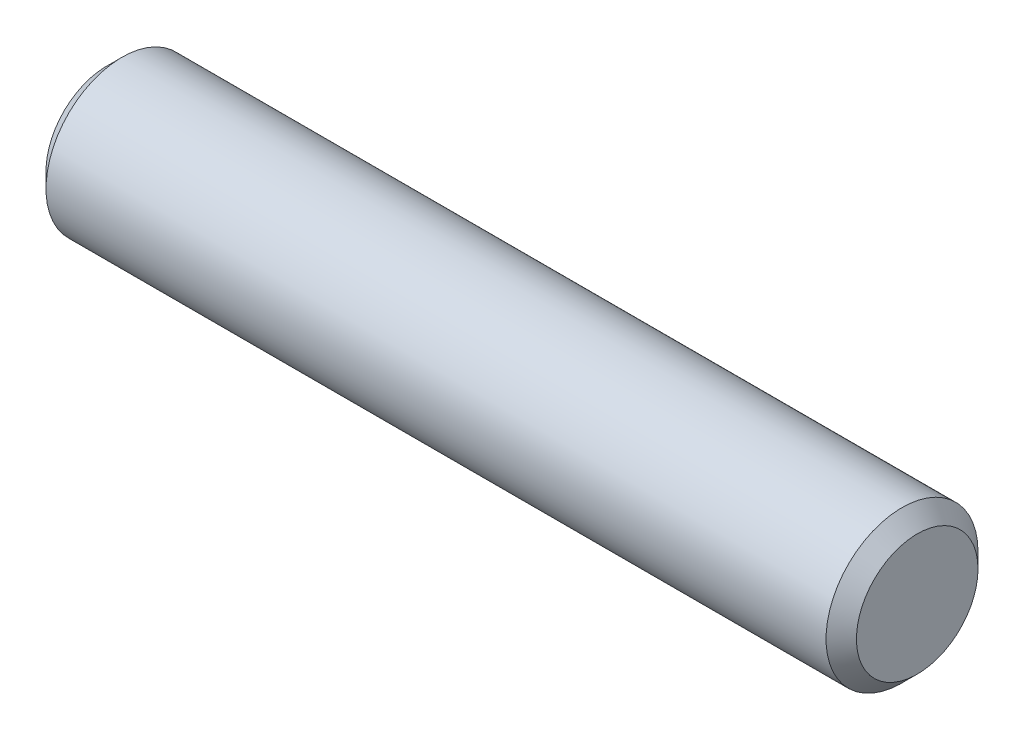
from build123d import *

# Parameters (mm, degrees)
EXTRUDE1_DEPTH      = 25.4
EXTRUDE1_DEPTH_BACK = 25.4
SKETCH2_R           = 4.7625
CHAMFER1_SIZE       = 0.9525


with BuildPart() as part:
    # Sketch2 → Extrude1 (new, two sides: drawn at the far end of the back side and taken through both)
    with BuildSketch(Plane(origin=(0, 0, 0), x_dir=(0, 0, -1), z_dir=(1, 0, 0)).offset(-EXTRUDE1_DEPTH_BACK)):
        Circle(SKETCH2_R)
    extrude(amount=EXTRUDE1_DEPTH + EXTRUDE1_DEPTH_BACK)

    # Chamfer1
    chamfer1_edges = [part.edges().sort_by_distance(p)[0] for p in [
        (-25.4, 0, 4.7625),
        (25.4, 0, 4.7625),
    ]]
    chamfer(chamfer1_edges, length=CHAMFER1_SIZE)


solid = part.part
